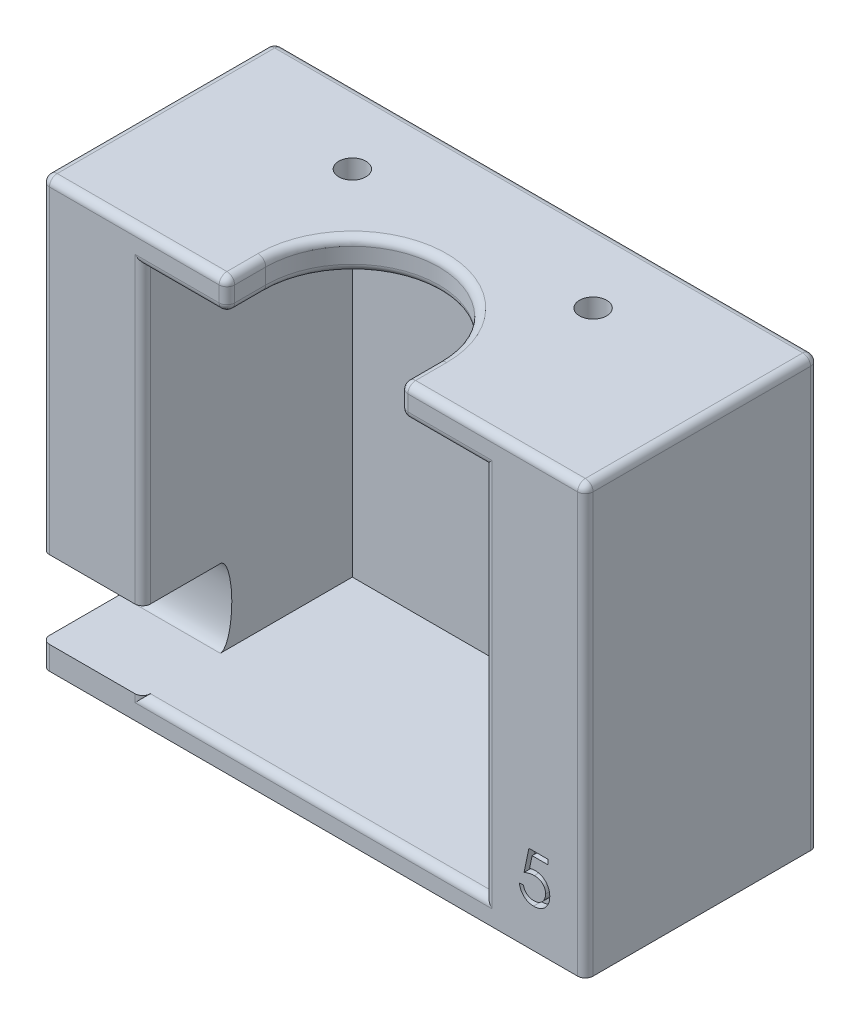
from build123d import *

# Parameters (mm, degrees)
CROQUIS1_W              = 70
CROQUIS1_H              = 30
SALIENTE_EXTRUIR1_DEPTH = 55
CROQUIS5_W              = 44
CROQUIS5_H              = 48
CORTAR_EXTRUIR3_DEPTH   = 27
CORTAR_EXTRUIR4_REACH   = 65.647
CROQUIS6_R              = 11.15
CORTAR_EXTRUIR5_START   = -4
CROQUIS7_W              = 22.3
CROQUIS7_H              = 5
CORTAR_EXTRUIR5_DEPTH   = 4
CROQUIS9_R              = 4.15
CORTAR_EXTRUIR6_DEPTH   = 27
REDONDEO1_R             = 1
CORTAR_EXTRUIR7_DEPTH   = 1
CORTAR_EXTRUIR8_REACH   = 68.895
CROQUIS11_R             = 1.75
CORTAR_EXTRUIR9_REACH   = 82.616


with BuildPart() as part:
    # Croquis1 → Saliente-Extruir1 (new body)
    with BuildSketch(Plane(origin=(0, 0, 0), x_dir=(1, 0, 0), z_dir=(0, 1, 0))):
        Rectangle(CROQUIS1_W, CROQUIS1_H)
    extrude(amount=SALIENTE_EXTRUIR1_DEPTH)

    # Croquis5 → Cortar-Extruir3 (cut)
    with BuildSketch(Plane.XY.offset(15)):
        with Locations((0, 27)):
            Rectangle(CROQUIS5_W, CROQUIS5_H)
    extrude(amount=-CORTAR_EXTRUIR3_DEPTH, mode=Mode.SUBTRACT)

    # Croquis6 → Cortar-Extruir4 (cut, up to next)
    with BuildSketch(Plane.XZ.offset(-51), mode=Mode.PRIVATE) as cortar_extruir4_sk1:
        with Locations((0, 10)):
            Circle(CROQUIS6_R)
    cortar_extruir4_tool1 = extrude(cortar_extruir4_sk1.sketch, amount=-CORTAR_EXTRUIR4_REACH, mode=Mode.PRIVATE) & part.part
    add(cortar_extruir4_tool1.solids().sort_by_distance((0, 51, 10))[0], mode=Mode.SUBTRACT)

    # Croquis7 → Cortar-Extruir5 (cut)
    with BuildSketch(Plane(origin=(0, 55, 0), x_dir=(1, 0, 0), z_dir=(0, 1, 0)).offset(CORTAR_EXTRUIR5_START)):
        with Locations((0, -12.5)):
            Rectangle(CROQUIS7_W, CROQUIS7_H)
    extrude(amount=CORTAR_EXTRUIR5_DEPTH, mode=Mode.SUBTRACT)

    # Croquis9 → Cortar-Extruir6 (cut)
    with BuildSketch(Plane(origin=(0, 0, -15), x_dir=(-1, 0, 0), z_dir=(0, 0, -1))):
        with Locations((-27.5, 32)):
            Circle(CROQUIS9_R)
        with Locations((27.5, 32)):
            Circle(CROQUIS9_R)
    extrude(amount=-CORTAR_EXTRUIR6_DEPTH, mode=Mode.SUBTRACT)

    # Redondeo1
    redondeo1_edges = [part.edges().sort_by_distance(p)[0] for p in [
        (-35, 55, 0),
        (-23.075, 55, 15),
        (-22, 27, 15),
        (0, 3, 15),
        (22, 27, 15),
        (16.575, 51, 15),
        (0, 55, -1.15),
        (23.075, 55, 15),
        (11.15, 51, 12.5),
        (35, 55, 0),
        (11.15, 55, 12.5),
        (11.15, 53, 15),
        (0, 51, -1.15),
        (-16.575, 51, 15),
        (-11.15, 51, 12.5),
        (-11.15, 55, 12.5),
        (-11.15, 53, 15),
        (0, 55, -15),
        (35, 27.5, 15),
        (-35, 27.5, 15),
        (-35, 27.5, -15),
        (35, 27.5, -15),
    ]]
    fillet(redondeo1_edges, radius=REDONDEO1_R)

    # Croquis10 → Cortar-Extruir7 (cut)
    with BuildSketch(Plane.XY.offset(15)):
        with BuildLine():
            Line((30.192307692, 11.128219757), (30.192307692, 10.512835142))
            Line((30.192307692, 10.512835142), (28.151442308, 10.512835142))
            Line((28.151442308, 10.512835142), (27.828125, 8.934710142))
            add(Edge.make_bspline(
                [(27.828125, 8.934710142), (27.891649356, 8.952247751), (28.014717749, 8.986224094), (28.196363225, 9.023948272), (28.368807002, 9.046689033), (28.480707637, 9.049794137), (28.534855769, 9.05129668)],
                knots=[0, 0, 0, 0, 1.100273476, 2.13160584, 3.095893838, 4, 4, 4, 4], degree=3))
            add(Edge.make_bspline(
                [(28.534855769, 9.05129668), (28.601856466, 9.049846505), (28.733596576, 9.046995098), (28.926349056, 9.019614784), (29.110348302, 8.976517788), (29.285209508, 8.916311179), (29.451256166, 8.839323065), (29.606960557, 8.743151739), (29.754659836, 8.630808885), (29.891704283, 8.501646008), (30.016031669, 8.359494665), (30.125344794, 8.2066526), (30.218194949, 8.044605179), (30.292870528, 7.871804136), (30.352500816, 7.690159873), (30.39218995, 7.49776116), (30.418618594, 7.296421525), (30.421571256, 7.158756548), (30.423076923, 7.088556296)],
                knots=[0, 0, 0, 0, 1.052922333, 2.070308379, 3.05430497, 4.020497103, 4.973039431, 5.925935799, 6.892292201, 7.88610001, 8.88166317, 9.857072816, 10.836096531, 11.812156883, 12.81219415, 13.836441305, 14.89672472, 16, 16, 16, 16], degree=3))
            add(Edge.make_bspline(
                [(30.423076923, 7.088556296), (30.421936794, 7.039661061), (30.419671944, 6.942531368), (30.408154365, 6.798284167), (30.385978852, 6.657090739), (30.35620561, 6.518932353), (30.317561465, 6.384070572), (30.27078023, 6.252119381), (30.213529897, 6.123900055), (30.150733254, 5.998199378), (30.080025006, 5.87785908), (30.001547565, 5.76531796), (29.918635294, 5.658887763), (29.82942149, 5.559709935), (29.733076927, 5.46843619), (29.630768413, 5.384524851), (29.523312323, 5.306556856), (29.409046193, 5.237697093), (29.290516222, 5.174332025), (29.166010707, 5.122348818), (29.038363792, 5.075873627), (28.905738291, 5.038828723), (28.768434612, 5.009801486), (28.626226426, 4.990086171), (28.479859563, 4.975726564), (28.380645256, 4.974827666), (28.330528846, 4.974373604)],
                knots=[0, 0, 0, 0, 1.056347294, 2.098418968, 3.122841568, 4.141288669, 5.149314143, 6.15115421, 7.162517403, 8.180376062, 9.185164535, 10.17417709, 11.141909838, 12.097768115, 13.052685741, 14.0056014, 14.954263652, 15.917497458, 16.885230207, 17.854509472, 18.828990115, 19.81800267, 20.826176721, 21.857883937, 22.917946725, 24, 24, 24, 24], degree=3))
            add(Edge.make_bspline(
                [(28.330528846, 4.974373604), (28.270744536, 4.975557897), (28.153125969, 4.977887855), (27.980804997, 5.002262401), (27.81500853, 5.037171972), (27.657071214, 5.089691292), (27.505577619, 5.155498083), (27.362567246, 5.238668663), (27.224385916, 5.332918555), (27.096650995, 5.444142017), (26.978097658, 5.565711758), (26.871972214, 5.697639142), (26.777457511, 5.837746757), (26.696067088, 5.986715022), (26.626641908, 6.144152503), (26.572101929, 6.310649076), (26.528081891, 6.485334797), (26.509458885, 6.605597958), (26.5, 6.666681296)],
                knots=[0, 0, 0, 0, 1.0467383, 2.05933395, 3.04377827, 4.011590433, 4.970194871, 5.932262533, 6.905835911, 7.896367577, 8.894135286, 9.877477877, 10.858688626, 11.851381753, 12.8477658, 13.868841284, 14.917554742, 16, 16, 16, 16], degree=3))
            Line((26.5, 6.666681296), (27.038461538, 6.666681296))
            add(Edge.make_bspline(
                [(27.038461538, 6.666681296), (27.051710494, 6.60946452), (27.077175722, 6.4994907), (27.133071291, 6.34497983), (27.201412792, 6.207289732), (27.28267739, 6.084599018), (27.379620299, 5.977612165), (27.490242177, 5.88226863), (27.614266845, 5.796254123), (27.75208381, 5.724557951), (27.897477661, 5.663411516), (28.049650021, 5.622694325), (28.204457472, 5.594064223), (28.309163249, 5.591198347), (28.361778846, 5.589758219)],
                knots=[0, 0, 0, 0, 1.136247022, 2.183929868, 3.172523383, 4.106158343, 5.02341133, 5.958108904, 6.928429099, 7.938127109, 8.96079061, 9.975095812, 10.982467395, 12, 12, 12, 12], degree=3))
            add(Edge.make_bspline(
                [(28.361778846, 5.589758219), (28.413136179, 5.591165267), (28.514259189, 5.593935755), (28.663078709, 5.615259776), (28.806757922, 5.648101327), (28.943879105, 5.69724965), (29.076841744, 5.756983453), (29.202282493, 5.833637869), (29.323830283, 5.921855043), (29.437707083, 6.022923552), (29.542003282, 6.134300171), (29.634156632, 6.253404274), (29.710917055, 6.380461725), (29.775604099, 6.513272844), (29.82472404, 6.653293228), (29.859765722, 6.799866671), (29.880342394, 6.953355209), (29.883172989, 7.058045454), (29.884615385, 7.111392834)],
                knots=[0, 0, 0, 0, 1.027316725, 2.022795036, 3.002884548, 3.971462791, 4.93288096, 5.914575861, 6.907176829, 7.935150275, 8.956128384, 9.956726525, 10.942570165, 11.921478529, 12.907843606, 13.90538589, 14.932640048, 16, 16, 16, 16], degree=3))
            add(Edge.make_bspline(
                [(29.884615385, 7.111392834), (29.883486563, 7.159522694), (29.881277054, 7.253730047), (29.863224648, 7.391557258), (29.831824124, 7.521968188), (29.78824033, 7.645592589), (29.732904031, 7.762547061), (29.665281781, 7.872952307), (29.584104528, 7.975353164), (29.491375576, 8.069797542), (29.389790363, 8.156960185), (29.27760109, 8.231264333), (29.157155501, 8.293773906), (29.029904759, 8.347719046), (28.892822076, 8.386463181), (28.748622134, 8.415550985), (28.595747778, 8.432377321), (28.491226598, 8.434711986), (28.4375, 8.435912065)],
                knots=[0, 0, 0, 0, 1.045622112, 2.046656509, 3.013763289, 3.955457236, 4.890082067, 5.820317437, 6.762574623, 7.722996705, 8.69280354, 9.665887285, 10.63943826, 11.638615906, 12.663482002, 13.728887084, 14.832589034, 16, 16, 16, 16], degree=3))
            add(Edge.make_bspline(
                [(28.4375, 8.435912065), (28.390993265, 8.434916766), (28.294968656, 8.432861726), (28.147672381, 8.417730588), (27.992886571, 8.393320369), (27.831204578, 8.359743945), (27.66214085, 8.315804956), (27.486052163, 8.263151527), (27.302568277, 8.200199529), (27.178937893, 8.152658591), (27.115384615, 8.128219757)],
                knots=[0, 0, 0, 0, 0.817624296, 1.688186739, 2.600797293, 3.572016777, 4.590301741, 5.671205678, 6.80286297, 8, 8, 8, 8], degree=3))
            Line((27.115384615, 8.128219757), (27.730769231, 11.128219757))
            Line((27.730769231, 11.128219757), (30.192307692, 11.128219757))
        make_face()
    extrude(amount=-CORTAR_EXTRUIR7_DEPTH, mode=Mode.SUBTRACT)

    # Croquis11 → Cortar-Extruir8 (cut, up to next)
    with BuildSketch(Plane(origin=(0, 55, 0), x_dir=(1, 0, 0), z_dir=(0, 1, 0)), mode=Mode.PRIVATE) as cortar_extruir8_sk1:
        with Locations(Location((-15.5, 5.5, 0), (0, 0, 270))):
            Circle(CROQUIS11_R)
    cortar_extruir8_tool1 = extrude(cortar_extruir8_sk1.sketch, amount=-CORTAR_EXTRUIR8_REACH, mode=Mode.PRIVATE) & part.part
    # Croquis11 → Cortar-Extruir8 (cut, up to next)
    with BuildSketch(Plane(origin=(0, 55, 0), x_dir=(1, 0, 0), z_dir=(0, 1, 0)), mode=Mode.PRIVATE) as cortar_extruir8_sk2:
        with Locations(Location((15.5, 5.5, 0), (0, 0, 270))):
            Circle(CROQUIS11_R)
    cortar_extruir8_tool2 = extrude(cortar_extruir8_sk2.sketch, amount=-CORTAR_EXTRUIR8_REACH, mode=Mode.PRIVATE) & part.part
    add(cortar_extruir8_tool1.solids().sort_by_distance((-15.5, 55, -5.5))[0], mode=Mode.SUBTRACT)
    add(cortar_extruir8_tool2.solids().sort_by_distance((15.5, 55, -5.5))[0], mode=Mode.SUBTRACT)

    # Croquis14 → Cortar-Extruir9 (cut, up to next)
    with BuildSketch(Plane(origin=(-22, 0, 0), x_dir=(0, 0, -1), z_dir=(1, 0, 0)), mode=Mode.PRIVATE) as cortar_extruir9_sk1:
        with BuildLine():
            Line((-15, 3), (-5, 3))
            add(Edge.make_bspline(
                [(-5, 3), (-3.519296534, 3), (-3.519296534, 8), (-3.519296534, 13), (-5, 13)],
                knots=[3.141592654, 3.141592654, 3.141592654, 4.71238898, 4.71238898, 6.283185307, 6.283185307, 6.283185307], degree=2, weights=[1, 0.707106781, 1, 0.707106781, 1]))
            Line((-5, 13), (-15, 13))
            Line((-15, 13), (-15, 3))
        make_face()
    cortar_extruir9_tool1 = extrude(cortar_extruir9_sk1.sketch, amount=-CORTAR_EXTRUIR9_REACH, mode=Mode.PRIVATE) & part.part
    add(cortar_extruir9_tool1.solids().sort_by_distance((-22, 8, 9.413236))[0], mode=Mode.SUBTRACT)


solid = part.part
